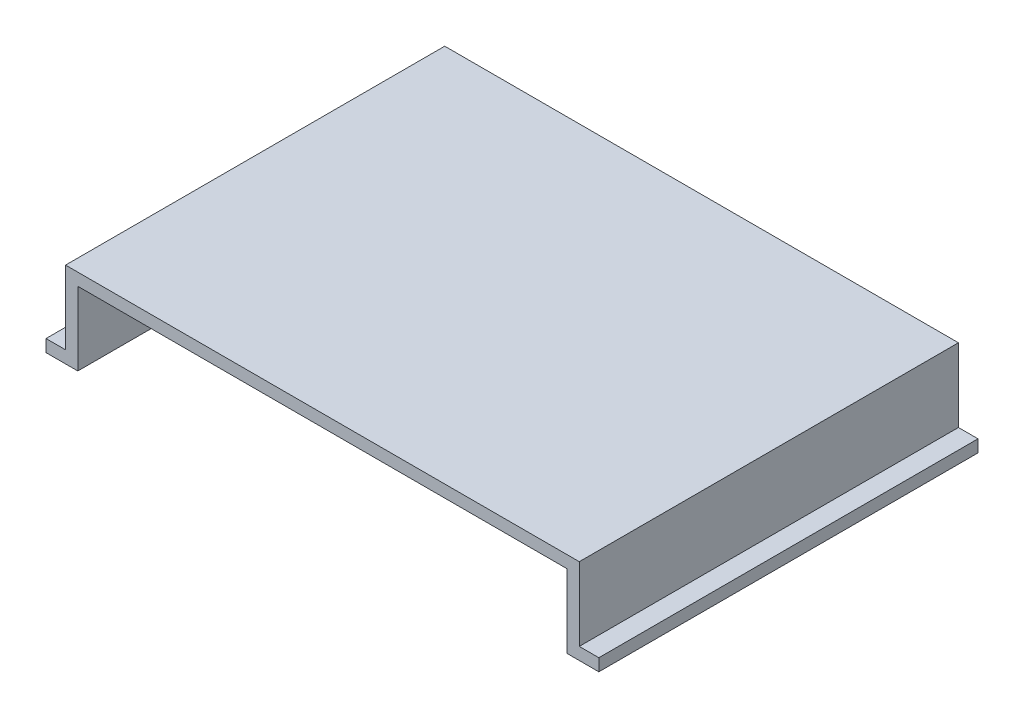
from build123d import *

# Parameters (mm, degrees)
SKETCH1_W           = 200
SKETCH1_H           = 150
BOSS_EXTRUDE1_DEPTH = 5
BOSS_EXTRUDE2_DEPTH = 35
SKETCH4_W           = 155
SKETCH4_H           = 5
BOSS_EXTRUDE3_DEPTH = 8
SKETCH5_W           = 155
SKETCH5_H           = 5
BOSS_EXTRUDE4_DEPTH = 8


with BuildPart() as part:
    # Sketch1 → Boss-Extrude1 (new body)
    with BuildSketch(Plane(origin=(0, 0, 0), x_dir=(1, 0, 0), z_dir=(0, 1, 0))):
        with Locations((100, -75)):
            Rectangle(SKETCH1_W, SKETCH1_H)
    extrude(amount=BOSS_EXTRUDE1_DEPTH)

    # Sketch2 → Boss-Extrude2 (add)
    with BuildSketch(Plane(origin=(0, 5, 0), x_dir=(1, 0, 0), z_dir=(0, 1, 0))):
        Polygon((0, -150), (-5, -150), (-5, 0), (-5, 5), (205, 5), (205, 0), (205, -150), (200, -150), (200, 0), (0, 0), align=None)
    extrude(amount=-BOSS_EXTRUDE2_DEPTH)

    # Sketch4 → Boss-Extrude3 (add)
    with BuildSketch(Plane(origin=(205, 0, 0), x_dir=(0, 0, -1), z_dir=(1, 0, 0))):
        with Locations((-72.5, -27.5)):
            Rectangle(SKETCH4_W, SKETCH4_H)
    extrude(amount=BOSS_EXTRUDE3_DEPTH)

    # Sketch5 → Boss-Extrude4 (add)
    with BuildSketch(Plane.ZY.offset(5)):
        with Locations((72.5, -27.5)):
            Rectangle(SKETCH5_W, SKETCH5_H)
    extrude(amount=BOSS_EXTRUDE4_DEPTH)


solid = part.part
